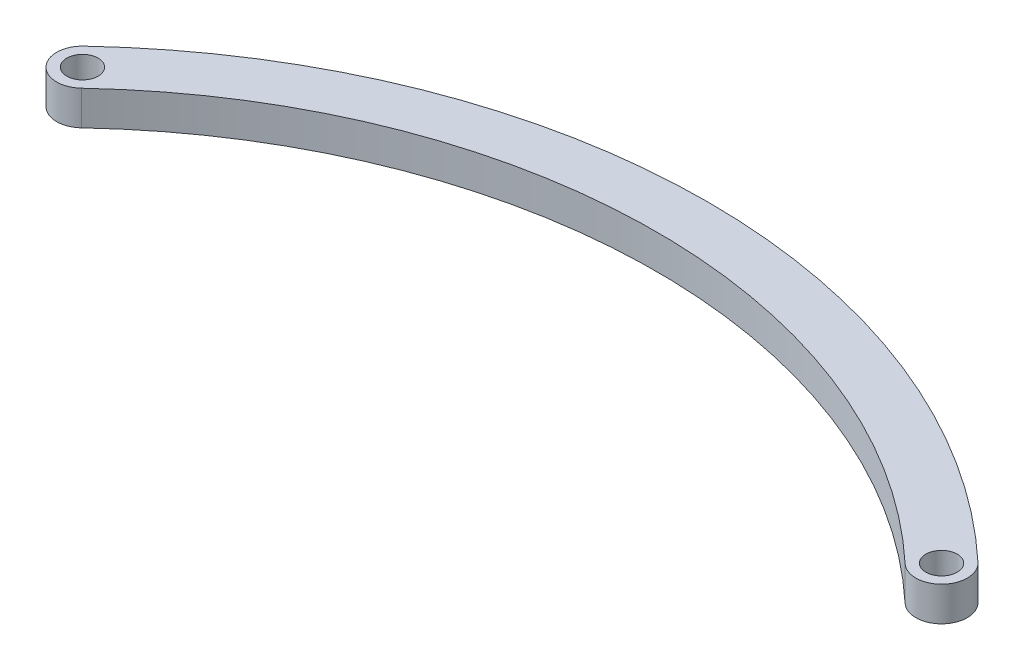
from build123d import *

# Parameters (mm, degrees)
ESQUISSE1_R        = 1.825
BOSS_EXTRU_1_DEPTH = 4


with BuildPart() as part:
    # Esquisse1 → Boss.-Extru.1 (new body)
    with BuildSketch(Plane(origin=(0, 0, 0), x_dir=(1, 0, 0), z_dir=(0, 1, 0))):
        with BuildLine():
            ThreePointArc((-52.054794536, 2.185822365), (-52.185822369, -2.054794533), (-47.945205471, -2.185822372))
            ThreePointArc((-47.945205471, -2.185822372), (-1.4e-08, 16.811655412), (47.94520545, -2.185822352))
            ThreePointArc((47.94520545, -2.185822352), (52.185822338, -2.054794566), (52.054794582, 2.185822323))
            ThreePointArc((52.054794582, 2.185822323), (3.1e-08, 22.811655412), (-52.054794536, 2.185822365))
        make_face()
        with Locations(Location((-50, 0, 0), (0, 0, 270))):
            Circle(ESQUISSE1_R, mode=Mode.SUBTRACT)
        with Locations(Location((50, 0, 0), (0, 0, 270))):
            Circle(ESQUISSE1_R, mode=Mode.SUBTRACT)
    extrude(amount=BOSS_EXTRU_1_DEPTH)


solid = part.part
